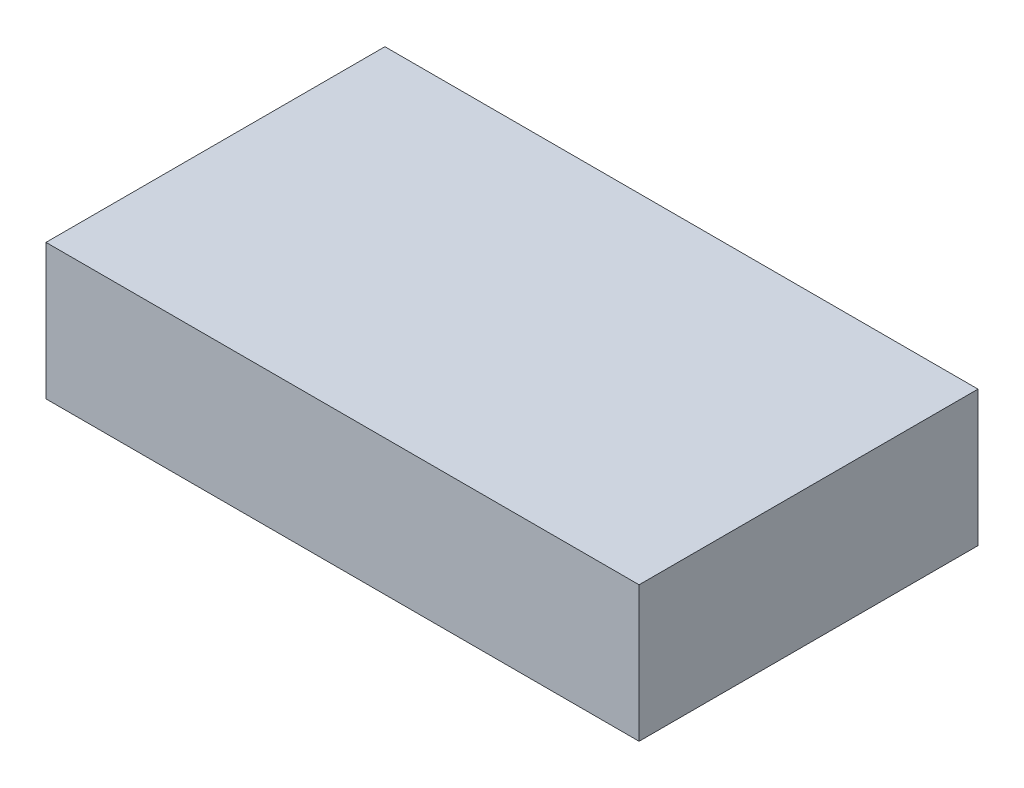
from build123d import *

# Parameters (mm, degrees)
SKETCH1_W           = 1750
SKETCH1_H           = 1000
BOSS_EXTRUDE1_DEPTH = 400


with BuildPart() as part:
    # Sketch1 → Boss-Extrude1 (new body)
    with BuildSketch(Plane(origin=(0, 0, 0), x_dir=(1, 0, 0), z_dir=(0, 1, 0))):
        with Locations((235.967741935, 271.935483871)):
            Rectangle(SKETCH1_W, SKETCH1_H)
    extrude(amount=BOSS_EXTRUDE1_DEPTH)


solid = part.part
